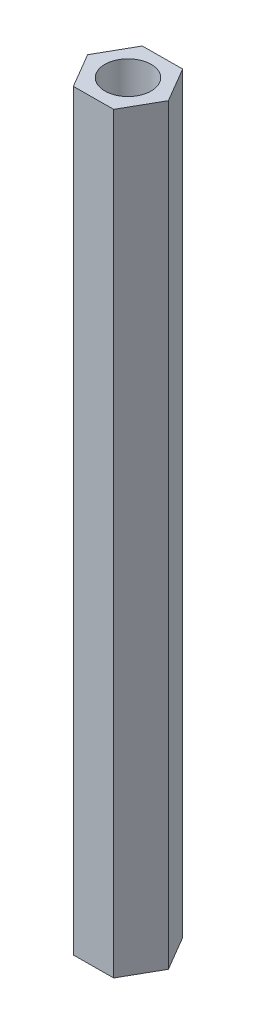
from build123d import *

# Parameters (mm, degrees)
SKETCH_2_R      = 2
EXTRUDE_1_DEPTH = 65


with BuildPart() as part:
    # 草图2 → 凸台-拉伸1 (new body)
    with BuildSketch(Plane(origin=(0, 0, 0), x_dir=(1, 0, 0), z_dir=(0, 1, 0))):
        Polygon((1.753256915, -2.987656304), (3.464014714, 0.024536876), (1.710757799, 3.01219318), (-1.753256915, 2.987656304), (-3.464014714, -0.024536876), (-1.710757799, -3.01219318), align=None)
        with Locations(Location((0, 0, 0), (0, 0, 270))):
            Circle(SKETCH_2_R, mode=Mode.SUBTRACT)
    extrude(amount=EXTRUDE_1_DEPTH)


solid = part.part
